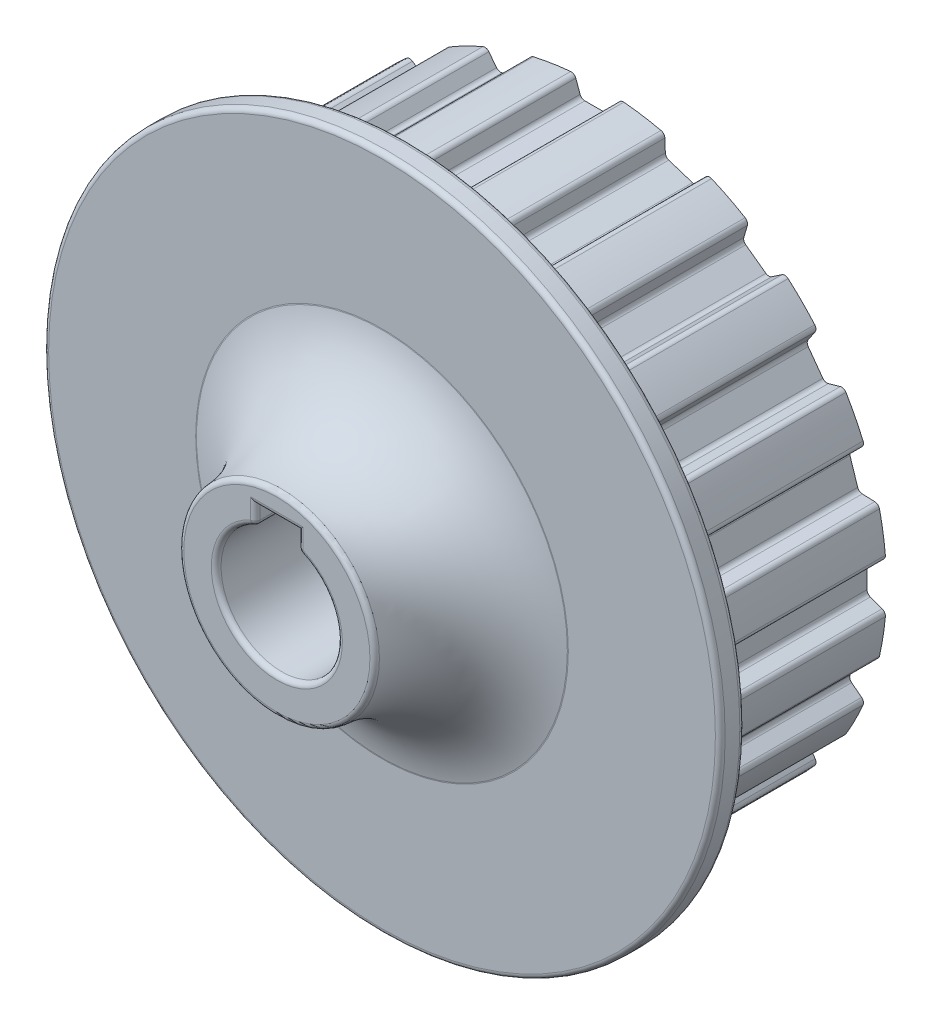
from build123d import *

# Parameters (mm, degrees)
BOSS_EXTRUDE1_DEPTH      = 7.25
BOSS_EXTRUDE1_DEPTH_BACK = 7.25
SKETCH7_R                = 29.575653678
CUT_EXTRUDE3_DEPTH       = 46.53502587
CUT_EXTRUDE3_DEPTH_BACK  = 46.53502587
SKETCH15_R               = 8.008120878
SKETCH15_R_2             = 2.25
BOSS_EXTRUDE2_DEPTH      = 5.5
SKETCH16_R               = 5
CUT_EXTRUDE4_DEPTH       = 3
BOSS_EXTRUDE3_START      = 7.5
SKETCH17_R               = 29.575653678
SKETCH17_R_2             = 5
BOSS_EXTRUDE3_DEPTH      = 7.5
CUT_EXTRUDE2_DEPTH       = 46.53502587
CUT_EXTRUDE2_DEPTH_BACK  = 46.53502587
FILLET2_R                = 0.51
BOSS_EXTRUDE4_START      = 2.5
SKETCH18_R               = 34.575653678
SKETCH18_R_2             = 29.575653678
SKETCH18_R_3             = 5
BOSS_EXTRUDE4_DEPTH      = 2.5
BOSS_EXTRUDE5_START      = -2.5
SKETCH19_R               = 34.575653678
SKETCH19_R_2             = 19
BOSS_EXTRUDE5_DEPTH      = 2.5
CUT_EXTRUDE5_DEPTH       = 61.27863763
FILLET3_R                = 0.5
SKETCH21_R               = 8.008120878
SKETCH21_R_2             = 6.2
SKETCH21_R_3             = 2.25
BOSS_EXTRUDE6_DEPTH      = 2.5
SKETCH21_4_R             = 8.008120878
SKETCH21_4_R_2           = 6.2
BOSS_EXTRUDE7_DEPTH      = 12
CUT_EXTRUDE7_DEPTH       = 10
CUT_EXTRUDE7_DEPTH_BACK  = 59.851628423
SKETCH23_R               = 1.75
CUT_EXTRUDE8_DEPTH       = 3
SKETCH25_R               = 1.75
BOSS_EXTRUDE8_DEPTH      = 0.2
CUT_EXTRUDE10_DEPTH      = 53.105198062
CUT_EXTRUDE10_DEPTH_BACK = 53.105198062
SKETCH22_W               = 69.151307356
SKETCH22_H               = 2.5


with BuildPart() as part:
    # Sketch7 → Boss-Extrude1 (new, two sides: drawn at the far end of the back side and taken through both)
    with BuildSketch(Plane.XY.offset(-BOSS_EXTRUDE1_DEPTH_BACK)):
        Circle(SKETCH7_R)
    extrude(amount=BOSS_EXTRUDE1_DEPTH + BOSS_EXTRUDE1_DEPTH_BACK)

    # Sketch14 → Revolve1 (revolve)
    with BuildSketch(Plane(origin=(0, 0, 0), x_dir=(0, 0, -1), z_dir=(1, 0, 0)), mode=Mode.PRIVATE) as revolve1_sk:
        Polygon((-18, 6.739517467), (-18, 0), (0, 0), (0, 19), (-3.355534752, 19), (-11.020158508, 12.583105693), align=None)
        with BuildLine():
            ThreePointArc((-7.25, 19), (-8.580081567, 15.465471544), (-11.020158508, 12.583105693))
            Line((-11.020158508, 12.583105693), (-3.355534752, 19))
            Line((-3.355534752, 19), (-7.25, 19))
        make_face()
        with BuildLine():
            Line((-18, 10), (-18, 6.739517467))
            Line((-18, 6.739517467), (-11.020158508, 12.583105693))
            ThreePointArc((-11.020158508, 12.583105693), (-14.286666254, 10.687865845), (-18, 10))
        make_face()
    revolve(revolve1_sk.sketch.rotate(Axis((0, 0, -36.129595921), (0, 0, 1)), 270), axis=Axis((0, 0, -36.129595921), (0, 0, 1)))

    # Sketch10 → Cut-Extrude3 (cut, two sides: drawn at the far end of the back side and taken through both)
    with BuildSketch(Plane.XY.offset(-CUT_EXTRUDE3_DEPTH_BACK)):
        with BuildLine():
            Line((2.2, 7.7), (-2.2, 7.7))
            Line((-2.2, 7.7), (-2.2, 5.796550698))
            ThreePointArc((-2.2, 5.796550698), (0, 6.2), (2.2, 5.796550698))
            Line((2.2, 5.796550698), (2.2, 7.7))
        make_face()
        with BuildLine():
            ThreePointArc((2.2, 5.796550698), (0, 6.2), (-2.2, 5.796550698))
            Line((-2.2, 5.796550698), (-2.2, 0))
            Line((-2.2, 0), (2.2, 0))
            Line((2.2, 0), (2.2, 5.796550698))
        make_face()
        with BuildLine():
            Line((-2.2, 0), (-2.2, 5.796550698))
            ThreePointArc((-2.2, 5.796550698), (-3.521363372, -5.102940329), (6.2, 0))
            ThreePointArc((6.2, 0), (5.102940329, 3.521363372), (2.2, 5.796550698))
            Line((2.2, 5.796550698), (2.2, 0))
            Line((2.2, 0), (-2.2, 0))
        make_face()
    extrude(amount=CUT_EXTRUDE3_DEPTH + CUT_EXTRUDE3_DEPTH_BACK, mode=Mode.SUBTRACT)

    # Sketch15 → Boss-Extrude2 (add)
    with BuildSketch(Plane(origin=(0, 0, -7.25), x_dir=(-1, 0, 0), z_dir=(0, 0, -1))):
        Circle(SKETCH15_R)
        Circle(SKETCH15_R_2, mode=Mode.SUBTRACT)
    extrude(amount=-BOSS_EXTRUDE2_DEPTH)

    # Sketch16 → Cut-Extrude4 (cut)
    with BuildSketch(Plane(origin=(0, 0, -7.25), x_dir=(-1, 0, 0), z_dir=(0, 0, -1))):
        Circle(SKETCH16_R)
    extrude(amount=-CUT_EXTRUDE4_DEPTH, mode=Mode.SUBTRACT)

    # Sketch17 → Boss-Extrude3 (add)
    with BuildSketch(Plane(origin=(0, 0, -7.25), x_dir=(-1, 0, 0), z_dir=(0, 0, -1)).offset(BOSS_EXTRUDE3_START)):
        with Locations(Location((0, 0, 0), (0, 0, 180))):
            Circle(SKETCH17_R)
        Circle(SKETCH17_R_2, mode=Mode.SUBTRACT)
    extrude(amount=-BOSS_EXTRUDE3_DEPTH)

    # Sketch8 → Cut-Extrude2 (cut, two sides: drawn at the far end of the back side and taken through both)
    with BuildSketch(Plane.XY.offset(-CUT_EXTRUDE2_DEPTH_BACK)):
        Polygon((-1.629816853, 27.574125652), (-2.358313477, 29.575653678), (2.358313477, 29.575653678), (1.629816853, 27.574125652), align=None)
        Polygon((6.970825494, 26.728192988), (6.896490207, 28.856877097), (11.382269006, 27.399359212), (10.07092137, 25.720910778), align=None)
        Polygon((14.889114872, 23.265918568), (15.476217378, 25.313388327), (19.29204874, 22.541024563), (17.526213935, 21.349953948), align=None)
        Polygon((21.349953948, 17.526213935), (22.541024563, 19.29204874), (25.313388327, 15.476217378), (23.265918568, 14.889114872), align=None)
        Polygon((25.720910778, 10.07092137), (27.399359212, 11.382269006), (28.856877097, 6.896490207), (26.728192988, 6.970825494), align=None)
        Polygon((27.574125652, 1.629816853), (29.575653678, 2.358313477), (29.575653678, -2.358313477), (27.574125652, -1.629816853), align=None)
        Polygon((26.728192988, -6.970825494), (28.856877097, -6.896490207), (27.399359212, -11.382269006), (25.720910778, -10.07092137), align=None)
        Polygon((23.265918568, -14.889114872), (25.313388327, -15.476217378), (22.541024563, -19.29204874), (21.349953948, -17.526213935), align=None)
        Polygon((17.526213935, -21.349953948), (19.29204874, -22.541024563), (15.476217378, -25.313388327), (14.889114872, -23.265918568), align=None)
        Polygon((10.07092137, -25.720910778), (11.382269006, -27.399359212), (6.896490207, -28.856877097), (6.970825494, -26.728192988), align=None)
        Polygon((1.629816853, -27.574125652), (2.358313477, -29.575653678), (-2.358313477, -29.575653678), (-1.629816853, -27.574125652), align=None)
        Polygon((-6.970825494, -26.728192988), (-6.896490207, -28.856877097), (-11.382269006, -27.399359212), (-10.07092137, -25.720910778), align=None)
        Polygon((-14.889114872, -23.265918568), (-15.476217378, -25.313388327), (-19.29204874, -22.541024563), (-17.526213935, -21.349953948), align=None)
        Polygon((-21.349953948, -17.526213935), (-22.541024563, -19.29204874), (-25.313388327, -15.476217378), (-23.265918568, -14.889114872), align=None)
        Polygon((-25.720910778, -10.07092137), (-27.399359212, -11.382269006), (-28.856877097, -6.896490207), (-26.728192988, -6.970825494), align=None)
        Polygon((-27.574125652, -1.629816853), (-29.575653678, -2.358313477), (-29.575653678, 2.358313477), (-27.574125652, 1.629816853), align=None)
        Polygon((-26.728192988, 6.970825494), (-28.856877097, 6.896490207), (-27.399359212, 11.382269006), (-25.720910778, 10.07092137), align=None)
        Polygon((-23.265918568, 14.889114872), (-25.313388327, 15.476217378), (-22.541024563, 19.29204874), (-21.349953948, 17.526213935), align=None)
        Polygon((-17.526213935, 21.349953948), (-19.29204874, 22.541024563), (-15.476217378, 25.313388327), (-14.889114872, 23.265918568), align=None)
        Polygon((-10.07092137, 25.720910778), (-11.382269006, 27.399359212), (-6.896490207, 28.856877097), (-6.970825494, 26.728192988), align=None)
    extrude(amount=CUT_EXTRUDE2_DEPTH + CUT_EXTRUDE2_DEPTH_BACK, mode=Mode.SUBTRACT)

    # Fillet2
    fillet2_edges = [part.edges().sort_by_distance(p)[0] for p in [
        (-27.322605317, -11.322302291, -3.75),
        (-28.759534341, -6.89988949, -3.75),
        (-26.728192988, -6.970825494, -3.75),
        (-25.720910778, -10.07092137, -3.75),
        (-22.486558005, -19.211298747, -3.75),
        (-25.219759429, -15.449369723, -3.75),
        (-23.265918568, -14.889114872, -3.75),
        (-21.349953948, -17.526213935, -3.75),
        (-15.449369723, -25.219759429, -3.75),
        (-19.211298747, -22.486558005, -3.75),
        (-17.526213935, -21.349953948, -3.75),
        (-14.889114872, -23.265918568, -3.75),
        (-6.89988949, -28.759534341, -3.75),
        (-11.322302291, -27.322605317, -3.75),
        (-10.07092137, -25.720910778, -3.75),
        (-6.970825494, -26.728192988, -3.75),
        (2.325, -29.484125652, -3.75),
        (-2.325, -29.484125652, -3.75),
        (-1.629816853, -27.574125652, -3.75),
        (1.629816853, -27.574125652, -3.75),
        (11.322302291, -27.322605317, -3.75),
        (6.89988949, -28.759534341, -3.75),
        (6.970825494, -26.728192988, -3.75),
        (10.07092137, -25.720910778, -3.75),
        (19.211298747, -22.486558005, -3.75),
        (15.449369723, -25.219759429, -3.75),
        (14.889114872, -23.265918568, -3.75),
        (17.526213935, -21.349953948, -3.75),
        (25.219759429, -15.449369723, -3.75),
        (22.486558005, -19.211298747, -3.75),
        (21.349953948, -17.526213935, -3.75),
        (23.265918568, -14.889114872, -3.75),
        (28.759534341, -6.89988949, -3.75),
        (27.322605317, -11.322302291, -3.75),
        (25.720910778, -10.07092137, -3.75),
        (26.728192988, -6.970825494, -3.75),
        (29.484125652, 2.325, -3.75),
        (29.484125652, -2.325, -3.75),
        (27.574125652, -1.629816853, -3.75),
        (27.574125652, 1.629816853, -3.75),
        (27.322605317, 11.322302291, -3.75),
        (28.759534341, 6.89988949, -3.75),
        (26.728192988, 6.970825494, -3.75),
        (25.720910778, 10.07092137, -3.75),
        (22.486558005, 19.211298747, -3.75),
        (25.219759429, 15.449369723, -3.75),
        (23.265918568, 14.889114872, -3.75),
        (21.349953948, 17.526213935, -3.75),
        (15.449369723, 25.219759429, -3.75),
        (19.211298747, 22.486558005, -3.75),
        (17.526213935, 21.349953948, -3.75),
        (14.889114872, 23.265918568, -3.75),
        (6.89988949, 28.759534341, -3.75),
        (11.322302291, 27.322605317, -3.75),
        (10.07092137, 25.720910778, -3.75),
        (6.970825494, 26.728192988, -3.75),
        (-28.759534341, 6.89988949, -3.75),
        (-27.322605317, 11.322302291, -3.75),
        (-25.720910778, 10.07092137, -3.75),
        (-26.728192988, 6.970825494, -3.75),
        (-29.484125652, -2.325, -3.75),
        (-29.484125652, 2.325, -3.75),
        (-27.574125652, 1.629816853, -3.75),
        (-27.574125652, -1.629816853, -3.75),
        (-25.219759429, 15.449369723, -3.75),
        (-22.486558005, 19.211298747, -3.75),
        (-21.349953948, 17.526213935, -3.75),
        (-23.265918568, 14.889114872, -3.75),
        (-19.211298747, 22.486558005, -3.75),
        (-15.449369723, 25.219759429, -3.75),
        (-14.889114872, 23.265918568, -3.75),
        (-17.526213935, 21.349953948, -3.75),
        (-11.322302291, 27.322605317, -3.75),
        (-6.89988949, 28.759534341, -3.75),
        (-6.970825494, 26.728192988, -3.75),
        (-10.07092137, 25.720910778, -3.75),
        (-2.325, 29.484125652, -3.75),
        (2.325, 29.484125652, -3.75),
        (1.629816853, 27.574125652, -3.75),
        (-1.629816853, 27.574125652, -3.75),
    ]]
    fillet(fillet2_edges, radius=FILLET2_R)

    # Sketch18 → Boss-Extrude4 (add)
    # profile 1 of 2: a face of its own
    with BuildSketch(Plane(origin=(0, 0, -14.75), x_dir=(-1, 0, 0), z_dir=(0, 0, -1)).offset(BOSS_EXTRUDE4_START)):
        Circle(SKETCH18_R)
        Circle(SKETCH18_R_2, mode=Mode.SUBTRACT)
    # profile 2 of 2: a face of its own
    with BuildSketch(Plane(origin=(0, 0, -14.75), x_dir=(-1, 0, 0), z_dir=(0, 0, -1)).offset(BOSS_EXTRUDE4_START)):
        Circle(SKETCH18_R_2)
        Circle(SKETCH18_R_3, mode=Mode.SUBTRACT)
    extrude(amount=-BOSS_EXTRUDE4_DEPTH)

    # Sketch19 → Boss-Extrude5 (add)
    with BuildSketch(Plane.XY.offset(7.25).offset(BOSS_EXTRUDE5_START)):
        with Locations(Location((0, 0, 0), (0, 0, 180))):
            Circle(SKETCH19_R)
        Circle(SKETCH19_R_2, mode=Mode.SUBTRACT)
    extrude(amount=BOSS_EXTRUDE5_DEPTH)

    # Sketch20 → Cut-Extrude5 (cut, through all)
    with BuildSketch(Plane.XY.offset(18)):
        with BuildLine():
            Line((-2.2, 7.7), (-2.2, 5.796550698))
            ThreePointArc((-2.2, 5.796550698), (0, 6.2), (2.2, 5.796550698))
            Line((2.2, 5.796550698), (2.2, 7.7))
            Line((2.2, 7.7), (-2.2, 7.7))
        make_face()
        with BuildLine():
            ThreePointArc((2.2, 5.796550698), (0, 6.2), (-2.2, 5.796550698))
            ThreePointArc((-2.2, 5.796550698), (-3.521363372, -5.102940329), (6.2, 0))
            ThreePointArc((6.2, 0), (5.102940329, 3.521363372), (2.2, 5.796550698))
        make_face()
    extrude(amount=-CUT_EXTRUDE5_DEPTH, mode=Mode.SUBTRACT)

    # Fillet3
    fillet3_edges = [part.edges().sort_by_distance(p)[0] for p in [
        (34.575653678, 0, 4.75),
        (34.575653678, 0, 7.25),
        (0, 7.7, 18),
        (2.2, 6.748275349, 18),
        (-2.2, 6.748275349, 18),
        (0, -6.2, 18),
        (2.2, 5.796550698, 0.375),
        (-2.2, 5.796550698, 0.375),
        (-19, 0, 7.25),
        (-10, 0, 18),
        (34.575653678, 0, -14.75),
        (34.575653678, 0, -17.25),
    ]]
    fillet(fillet3_edges, radius=FILLET3_R)

    # Sketch21 → Boss-Extrude6 (add)
    # profile 1 of 2: a face of its own
    with BuildSketch(Plane.XY.offset(-5.25)):
        Circle(SKETCH21_R)
        Circle(SKETCH21_R_2, mode=Mode.SUBTRACT)
    # profile 2 of 2: a face of its own
    with BuildSketch(Plane.XY.offset(-5.25)):
        Circle(SKETCH21_R_2)
        Circle(SKETCH21_R_3, mode=Mode.SUBTRACT)
    extrude(amount=-BOSS_EXTRUDE6_DEPTH)

    # Sketch21<4> → Boss-Extrude7 (add)
    with BuildSketch(Plane.XY.offset(-5.25)):
        Circle(SKETCH21_4_R)
        Circle(SKETCH21_4_R_2, mode=Mode.SUBTRACT)
    extrude(amount=-BOSS_EXTRUDE7_DEPTH)

    # Sketch23 → Cut-Extrude7 (cut, two sides: drawn at the far end of the back side and taken through both)
    with BuildSketch(Plane.XY.offset(-14.75).offset(-CUT_EXTRUDE7_DEPTH_BACK)):
        with Locations((0, -16.887062826)):
            Circle(SKETCH23_R)
        with Locations((-14.624625403, 8.443531413)):
            Circle(SKETCH23_R)
        with Locations((14.624625403, 8.443531413)):
            Circle(SKETCH23_R)
    extrude(amount=CUT_EXTRUDE7_DEPTH + CUT_EXTRUDE7_DEPTH_BACK, mode=Mode.SUBTRACT)

    # Sketch24 → Cut-Extrude8 (cut)
    with BuildSketch(Plane.XY.offset(-12.25)):
        Polygon((-14.624625403, 5.094899852), (-11.724625403, 6.769215632), (-11.724625403, 10.117847194), (-14.624625403, 11.792162974), (-17.524625403, 10.117847194), (-17.524625403, 6.769215632), align=None)
        Polygon((2.9, -18.561378607), (2.9, -15.212747045), (0, -13.538431265), (-2.9, -15.212747045), (-2.9, -18.561378607), (0, -20.235694387), align=None)
        Polygon((14.624625403, 5.094899852), (17.524625403, 6.769215632), (17.524625403, 10.117847194), (14.624625403, 11.792162974), (11.724625403, 10.117847194), (11.724625403, 6.769215632), align=None)
    extrude(amount=CUT_EXTRUDE8_DEPTH, mode=Mode.SUBTRACT)

    # Sketch25 → Boss-Extrude8 (add)
    with BuildSketch(Plane(origin=(0, 0, -9.25), x_dir=(-1, 0, 0), z_dir=(0, 0, -1))):
        with Locations(Location((0, -16.887062826, 0), (0, 0, 180))):
            Circle(SKETCH25_R)
        with Locations(Location((14.624625403, 8.443531413, 0), (0, 0, 180))):
            Circle(SKETCH25_R)
        with Locations(Location((-14.624625403, 8.443531413, 0), (0, 0, 180))):
            Circle(SKETCH25_R)
    extrude(amount=-BOSS_EXTRUDE8_DEPTH)

    # Sketch22 → Cut-Extrude10 (cut, two sides: drawn at the far end of the back side and taken through both)
    with BuildSketch(Plane(origin=(0, 0, 0), x_dir=(1, 0, 0), z_dir=(0, 1, 0)).offset(-CUT_EXTRUDE10_DEPTH_BACK)):
        with Locations((0, 16)):
            Rectangle(SKETCH22_W, SKETCH22_H)
    extrude(amount=CUT_EXTRUDE10_DEPTH + CUT_EXTRUDE10_DEPTH_BACK, mode=Mode.SUBTRACT)


solid = part.part
